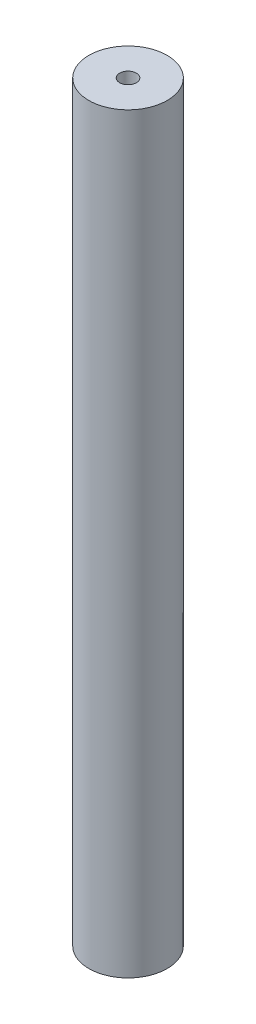
from build123d import *


with BuildPart() as part:
    # Sketch1 → Revolve2 (revolve)
    with BuildSketch(Plane(origin=(0, 0, 0), x_dir=(0, 0, -1), z_dir=(1, 0, 0)), mode=Mode.PRIVATE) as revolve2_sk:
        Polygon((-2.54, 0), (-2.54, 222.25), (-11.8999, 222.25), (-11.8999, -6.35), (-6.35, 0), align=None)
    revolve(revolve2_sk.sketch.rotate(Axis((0, 0, 0), (0, 1, 0)), 180), axis=Axis((0, 0, 0), (0, 1, 0)))


solid = part.part
